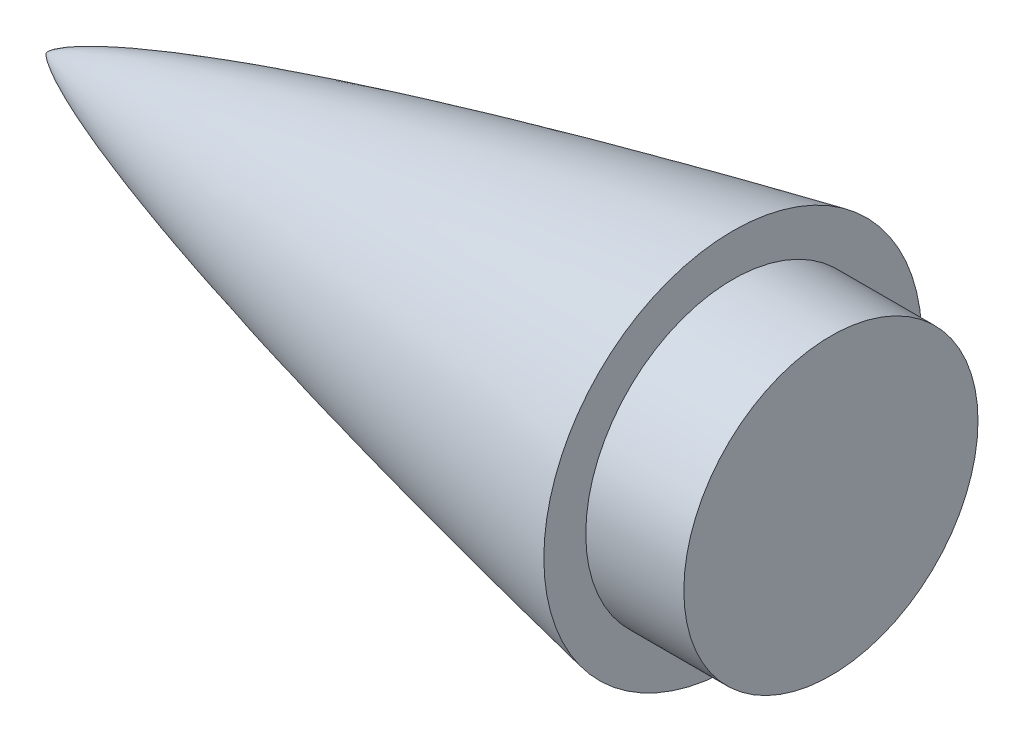
from build123d import *


with BuildPart() as part:
    # Sketch1 → Revolve1 (revolve)
    with BuildSketch(Plane.XY):
        with BuildLine():
            Line((0, 0), (50.8, 0))
            Line((50.8, 0), (50.8, 9.525))
            Line((50.8, 9.525), (44.45, 9.525))
            Line((44.45, 9.525), (44.45, 12.240378041))
            add(Edge.make_bspline(
                [(0, 0), (0.003011993, 0.009762905), (0.010551133, 0.02627483), (0.02586653, 0.047678002), (0.049584294, 0.077338244), (0.081109462, 0.111493124), (0.128401712, 0.157512982), (0.205163795, 0.22377356), (0.332159509, 0.321448772), (0.544576149, 0.465759826), (0.901635526, 0.680174208), (1.511388987, 1.001718774), (2.462796137, 1.442793313), (4.09295059, 2.111247407), (6.381601098, 2.935896342), (9.2264135, 3.855300668), (12.493682634, 4.822076041), (15.835168377, 5.743262471), (19.15770136, 6.611100285), (22.540430849, 7.451044456), (25.848575151, 8.242583043), (29.298149728, 9.033648458), (32.531227192, 9.756334274), (36.13463826, 10.530595732), (39.137485197, 11.164854423), (42.141706028, 11.776943106), (43.678800663, 12.086444554), (44.45, 12.240378041)],
                knots=[0, 0, 0, 0, 0, 0.000801269, 0.001433793, 0.002050484, 0.002997487, 0.004453093, 0.006630366, 0.010023953, 0.015611291, 0.024645739, 0.039425352, 0.064225022, 0.098209944, 0.163173804, 0.23114372, 0.299113647, 0.36708357, 0.435053499, 0.503023422, 0.570993349, 0.638963275, 0.7069332, 0.774903126, 0.842873051, 0.910842976, 0.910842976, 0.910842976, 0.910842976, 0.910842976], degree=4))
        make_face()
    revolve(axis=Axis((0, 0, 0), (1, 0, 0)))


solid = part.part
